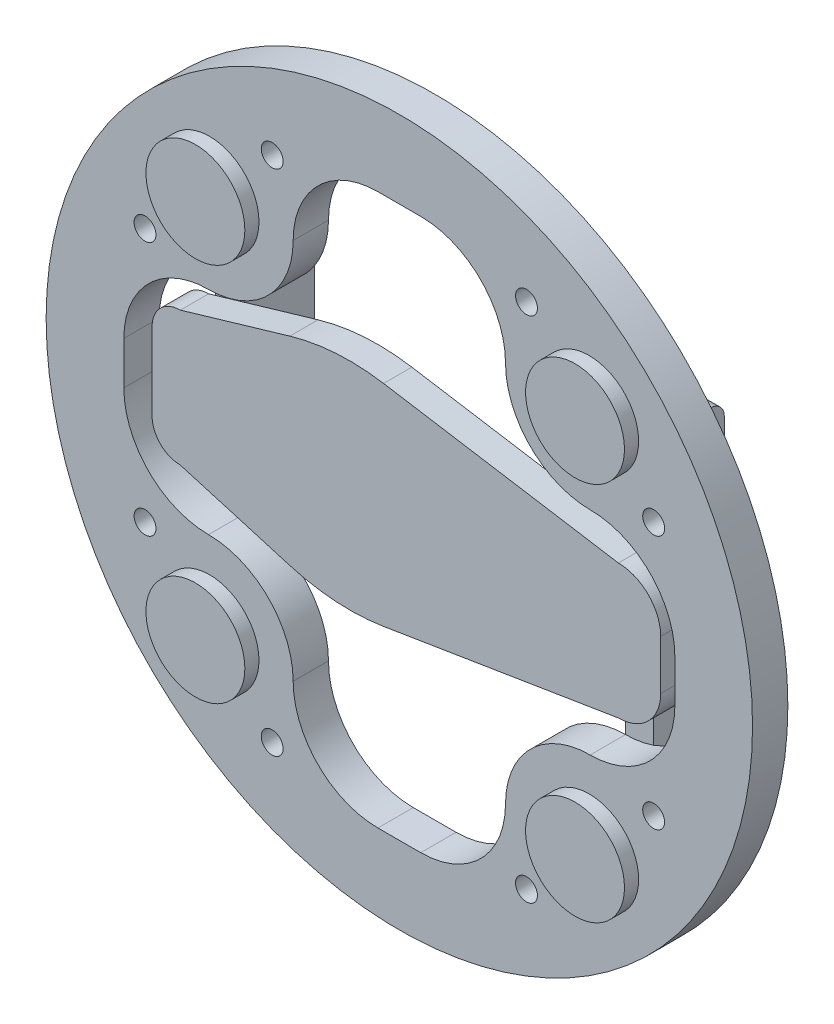
from build123d import *

# Parameters (mm, degrees)
CROQUIS1_R                = 7
SALIENTE_EXTRUIR1_DEPTH   = 7
SALIENTE_EXTRUIR1_2_DEPTH = 7
SALIENTE_EXTRUIR1_3_DEPTH = 7
SALIENTE_EXTRUIR1_4_DEPTH = 7
CROQUIS3_R                = 50
CROQUIS3_R_2              = 1.55
SALIENTE_EXTRUIR2_DEPTH   = 5
CROQUIS5_W                = 78
CROQUIS5_H                = 30.06
CORTAR_EXTRUIR1_DEPTH     = 5
CROQUIS6_W                = 30.06
CROQUIS6_H                = 78
CORTAR_EXTRUIR2_DEPTH     = 5
REDONDEO1_R               = 12
REDONDEO2_R               = 12
CROQUIS7_W                = 4
CROQUIS7_H                = 46
SALIENTE_EXTRUIR3_DEPTH   = 10
REDONDEO3_R               = 2
REDONDEO3_OF_SIMETR_A1_R  = 2
SALIENTE_EXTRUIR4_DEPTH   = 4


with BuildPart() as part:
    # Croquis1 → Saliente-Extruir1 (new body)
    with BuildSketch(Plane.XY):
        with Locations((-26.87, 26.87)):
            Circle(CROQUIS1_R)
    extrude(amount=SALIENTE_EXTRUIR1_DEPTH)



with BuildPart() as body_2:
    # Croquis1 → Saliente-Extruir1 2 (new body)
    with BuildSketch(Plane.XY):
        with Locations((-26.87, -26.87)):
            Circle(CROQUIS1_R)
    extrude(amount=SALIENTE_EXTRUIR1_2_DEPTH)


with BuildPart() as body_3:
    # Croquis1 → Saliente-Extruir1 3 (new body)
    with BuildSketch(Plane.XY):
        with Locations((26.87, -26.87)):
            Circle(CROQUIS1_R)
    extrude(amount=SALIENTE_EXTRUIR1_3_DEPTH)


with BuildPart() as body_4:
    # Croquis1 → Saliente-Extruir1 4 (new body)
    with BuildSketch(Plane.XY):
        with Locations((26.87, 26.87)):
            Circle(CROQUIS1_R)
    extrude(amount=SALIENTE_EXTRUIR1_4_DEPTH)


with BuildPart() as part_1:
    add(part.part)

    add(body_2.part)  # Saliente-Extruir2 merges body 2

    add(body_3.part)  # Saliente-Extruir2 merges body 3

    add(body_4.part)  # Saliente-Extruir2 merges body 4
    # Croquis3 → Saliente-Extruir2 (add)
    with BuildSketch(Plane.XY):
        Circle(CROQUIS3_R)
        with Locations((-36, 18)):
            Circle(CROQUIS3_R_2, mode=Mode.SUBTRACT)
        with Locations((18, 36)):
            Circle(CROQUIS3_R_2, mode=Mode.SUBTRACT)
        with Locations((36, -18)):
            Circle(CROQUIS3_R_2, mode=Mode.SUBTRACT)
        with Locations((-18, -36)):
            Circle(CROQUIS3_R_2, mode=Mode.SUBTRACT)
        with Locations((-18, 36)):
            Circle(CROQUIS3_R_2, mode=Mode.SUBTRACT)
        with Locations((36, 18)):
            Circle(CROQUIS3_R_2, mode=Mode.SUBTRACT)
        with Locations((18, -36)):
            Circle(CROQUIS3_R_2, mode=Mode.SUBTRACT)
        with Locations((-36, -18)):
            Circle(CROQUIS3_R_2, mode=Mode.SUBTRACT)
    extrude(amount=SALIENTE_EXTRUIR2_DEPTH)

    # Croquis5 → Cortar-Extruir1 (cut)
    with BuildSketch(Plane.XY.offset(5)):
        Rectangle(CROQUIS5_W, CROQUIS5_H)
    extrude(amount=-CORTAR_EXTRUIR1_DEPTH, mode=Mode.SUBTRACT)

    # Croquis6 → Cortar-Extruir2 (cut)
    with BuildSketch(Plane.XY.offset(5)):
        Rectangle(CROQUIS6_W, CROQUIS6_H)
    extrude(amount=-CORTAR_EXTRUIR2_DEPTH, mode=Mode.SUBTRACT)

    # Redondeo1
    redondeo1_edges = [part_1.edges().sort_by_distance(p)[0] for p in [
        (15.03, 15.03, 2.5),
        (-15.03, 15.03, 2.5),
        (-15.03, -15.03, 2.5),
        (15.03, -15.03, 2.5),
    ]]
    fillet(redondeo1_edges, radius=REDONDEO1_R)

    # Redondeo2
    redondeo2_edges = [part_1.edges().sort_by_distance(p)[0] for p in [
        (-39, -15.03, 2.5),
        (-39, 15.03, 2.5),
        (39, -15.03, 2.5),
        (39, 15.03, 2.5),
        (15.03, 39, 2.5),
        (-15.03, 39, 2.5),
        (15.03, -39, 2.5),
        (-15.03, -39, 2.5),
    ]]
    fillet(redondeo2_edges, radius=REDONDEO2_R)

    # Croquis7 → Saliente-Extruir3 (add)
    with BuildSketch(Plane(origin=(0, 0, 0), x_dir=(-1, 0, 0), z_dir=(0, 0, -1))):
        with Locations((-29, 0)):
            Rectangle(CROQUIS7_W, CROQUIS7_H)
    saliente_extruir3 = extrude(amount=SALIENTE_EXTRUIR3_DEPTH)

    # Redondeo3
    redondeo3_edges = [part_1.edges().sort_by_distance(p)[0] for p in [
        (29, -23, -10),
        (29, 23, -10),
    ]]
    fillet(redondeo3_edges, radius=REDONDEO3_R)

    # Simetría1: Saliente-Extruir3 across plane
    add(saliente_extruir3.mirror(Plane(origin=(0, 0, 0), x_dir=(0, 0, 1), z_dir=(1, 0, 0))))

    # Redondeo3 of Simetría1
    redondeo3_of_simetr_a1_edges = [part_1.edges().sort_by_distance(p)[0] for p in [
        (-29, -23, -10),
        (-29, 23, -10),
    ]]
    fillet(redondeo3_of_simetr_a1_edges, radius=REDONDEO3_OF_SIMETR_A1_R)

    # Croquis8 → Saliente-Extruir4 (add)
    with BuildSketch(Plane.XY):
        with BuildLine():
            Line((-36, 5.5), (-36, -5.5))
            ThreePointArc((-36, -5.5), (-34.828427125, -8.328427125), (-32, -9.5))
            Line((-32, -9.5), (-16.502329692, -14.059999635))
            ThreePointArc((-16.502329692, -14.059999635), (-9.912089885, -15.221135668), (-3.228413615, -14.892549106))
            Line((-3.228413615, -14.892549106), (30, -9.5))
            ThreePointArc((30, -9.5), (34.242640687, -7.742640687), (36, -3.5))
            Line((36, -3.5), (36, 3.5))
            ThreePointArc((36, 3.5), (34.242640687, 7.742640687), (30, 9.5))
            Line((30, 9.5), (-3.228413615, 14.892549106))
            ThreePointArc((-3.228413615, 14.892549106), (-9.912089885, 15.221135668), (-16.502329692, 14.059999635))
            Line((-16.502329692, 14.059999635), (-32, 9.5))
            ThreePointArc((-32, 9.5), (-34.828427125, 8.328427125), (-36, 5.5))
        make_face()
    extrude(amount=SALIENTE_EXTRUIR4_DEPTH)


solid = part_1.part
